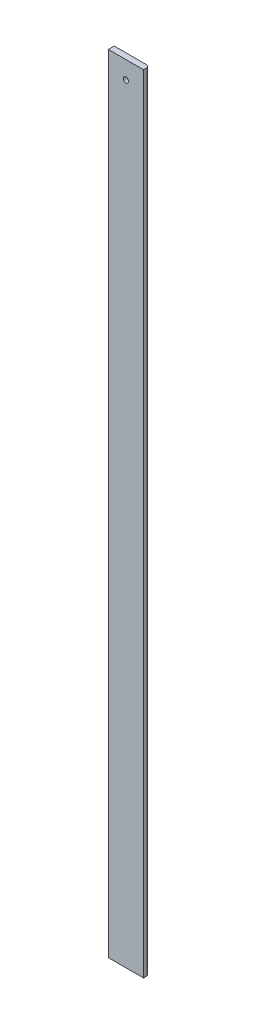
from build123d import *

# Parameters (mm, degrees)
BOSS_EXTRUDE1_DEPTH = 431.8
SKETCH4_W           = 15.875
SKETCH4_H           = 25.4
CUT_EXTRUDE1_DEPTH  = 6.35
SKETCH5_W           = 1.5875
SKETCH5_H           = 25.4
CUT_EXTRUDE2_DEPTH  = 6.35
SKETCH6_R           = 1.4224
CUT_EXTRUDE3_DEPTH  = 5.08
CUT_EXTRUDE4_START  = -6.35
CUT_EXTRUDE4_DEPTH  = 6.35
SKETCH8_R           = 1.4224
CUT_EXTRUDE5_DEPTH  = 5.08


with BuildPart() as part:
    # Sketch2 → Boss-Extrude1 (new body)
    with BuildSketch(Plane(origin=(0, 0, 0), x_dir=(1, 0, 0), z_dir=(0, 1, 0))):
        with BuildLine():
            Line((0, 0), (19.05, 0))
            Line((19.05, 0), (19.05, 1.5875))
            ThreePointArc((19.05, 1.5875), (18.585032015, 2.710032015), (17.4625, 3.175))
            Line((17.4625, 3.175), (4.7625, 3.175))
            ThreePointArc((4.7625, 3.175), (3.639967985, 3.639967985), (3.175, 4.7625))
            Line((3.175, 4.7625), (3.175, 17.4625))
            ThreePointArc((3.175, 17.4625), (2.710032015, 18.585032015), (1.5875, 19.05))
            Line((1.5875, 19.05), (0, 19.05))
            Line((0, 19.05), (0, 0))
        make_face()
    extrude(amount=BOSS_EXTRUDE1_DEPTH)

    # Sketch4 → Cut-Extrude1 (cut)
    with BuildSketch(Plane(origin=(3.175, 0, 0), x_dir=(0, 0, -1), z_dir=(1, 0, 0))):
        with Locations((11.1125, 419.1)):
            Rectangle(SKETCH4_W, SKETCH4_H)
    extrude(amount=-CUT_EXTRUDE1_DEPTH, mode=Mode.SUBTRACT)

    # Sketch5 → Cut-Extrude2 (cut)
    with BuildSketch(Plane.ZY.offset(-3.175)):
        with Locations((-3.96875, 419.1)):
            Rectangle(SKETCH5_W, SKETCH5_H)
    extrude(amount=-CUT_EXTRUDE2_DEPTH, mode=Mode.SUBTRACT)

    # Sketch6 → Cut-Extrude3 (cut)
    with BuildSketch(Plane(origin=(3.175, 0, 0), x_dir=(0, 0, -1), z_dir=(1, 0, 0))):
        with Locations((11.1125, 109.5375)):
            Circle(SKETCH6_R)
        with Locations((11.1125, 203.2)):
            Circle(SKETCH6_R)
        with Locations((11.1125, 296.8625)):
            Circle(SKETCH6_R)
        with Locations((11.1125, 11.1125)):
            Circle(SKETCH6_R)
        with Locations((11.1125, 395.2875)):
            Circle(SKETCH6_R)
    extrude(amount=-CUT_EXTRUDE3_DEPTH, mode=Mode.SUBTRACT)

    # Sketch7 → Cut-Extrude4 (cut)
    with BuildSketch(Plane(origin=(0, 431.8, 0), x_dir=(1, 0, 0), z_dir=(0, 1, 0)).offset(CUT_EXTRUDE4_START)):
        with BuildLine():
            Line((17.4625, 3.175), (0, 3.175))
            Line((0, 3.175), (0, 0))
            Line((0, 0), (19.05, 0))
            Line((19.05, 0), (19.05, 1.5875))
            ThreePointArc((19.05, 1.5875), (18.585032015, 2.710032015), (17.4625, 3.175))
        make_face()
    extrude(amount=CUT_EXTRUDE4_DEPTH, mode=Mode.SUBTRACT)

    # Sketch8 → Cut-Extrude5 (cut)
    with BuildSketch(Plane(origin=(0, 0, -3.175), x_dir=(-1, 0, 0), z_dir=(0, 0, -1))):
        with Locations((-9.525, 415.925)):
            Circle(SKETCH8_R)
    extrude(amount=-CUT_EXTRUDE5_DEPTH, mode=Mode.SUBTRACT)


solid = part.part
